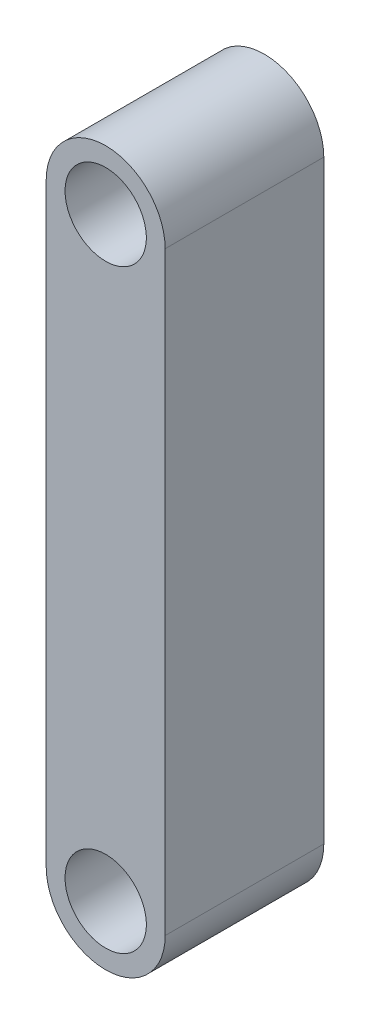
from build123d import *

# Parameters (mm, degrees)
BOSS_EXTRUDE1_DEPTH     = 8
F_4_0_MM_DOWEL_HOLES1_D = 4.1


with BuildPart() as part:
    # Sketch1 → Boss-Extrude1 (new body)
    with BuildSketch(Plane.XY):
        with BuildLine():
            Line((-3, 15), (-3, -15))
            ThreePointArc((-3, -15), (0, -18), (3, -15))
            Line((3, -15), (3, 15))
            ThreePointArc((3, 15), (0, 18), (-3, 15))
        make_face()
    extrude(amount=BOSS_EXTRUDE1_DEPTH)

    # Ø4.0 mm Dowel Holes1 (through all)
    with Locations(Plane(origin=(0, 0, 0), x_dir=(-1, 0, 0), z_dir=(0, 0, -1))):
        with Locations((0, 15)):
            f_4_0_mm_dowel_holes1 = Hole(F_4_0_MM_DOWEL_HOLES1_D / 2)

    # Mirror1: Ø4.0 mm Dowel Holes1 across plane
    add(f_4_0_mm_dowel_holes1.mirror(Plane.ZX), mode=Mode.SUBTRACT)


solid = part.part
